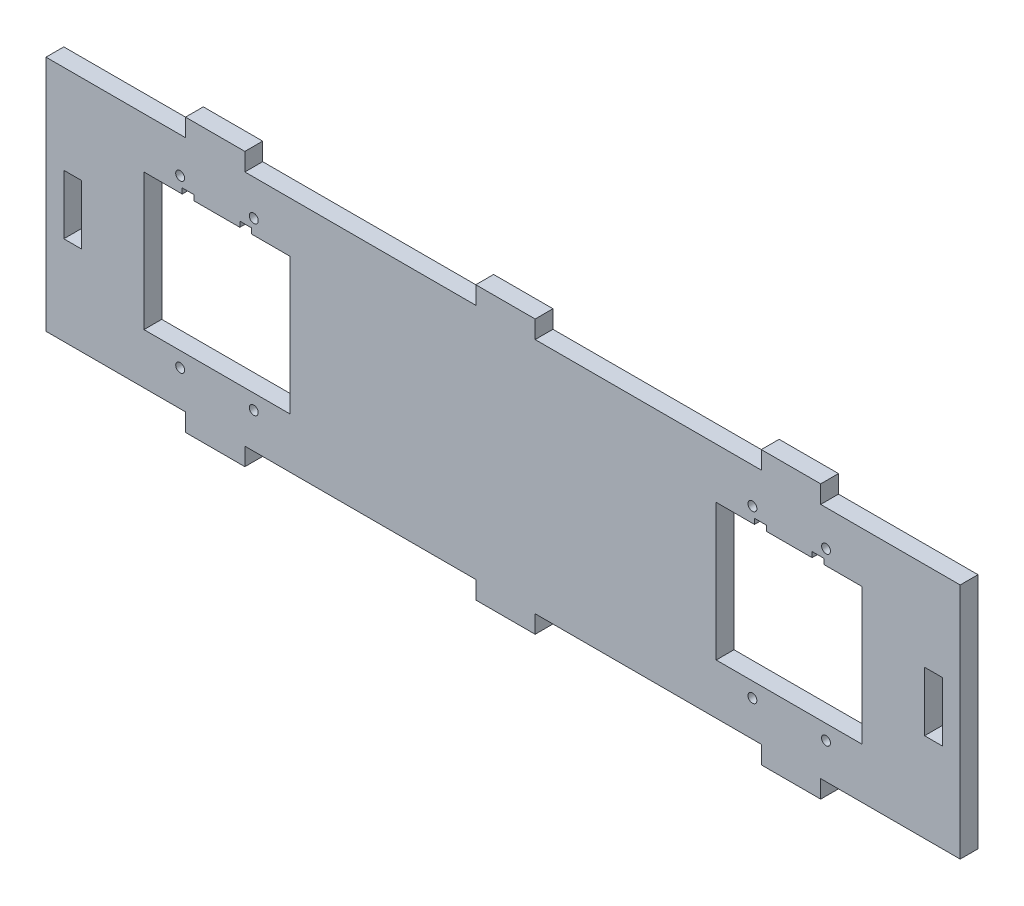
from build123d import *

# Parameters (mm, degrees)
SKETCH_1_R      = 0.75
SKETCH_1_W      = 3
SKETCH_1_H      = 10
EXTRUDE_1_DEPTH = 3


with BuildPart() as part:
    # 草图1 → 凸台-拉伸1 (new body)
    with BuildSketch(Plane.XY):
        Polygon((-43.5, -20), (-4.599481492, -20), (-4.599481492, -23), (5.400518508, -23), (5.400518508, -20), (43.5, -20), (43.5, -23), (53.5, -23), (53.5, -20), (77, -20), (77, 20), (53.5, 20), (53.5, 23), (43.5, 23), (43.5, 20), (5.400518508, 20), (5.400518508, 23), (-4.599481492, 23), (-4.599481492, 20), (-43.5, 20), (-43.5, 23), (-53.5, 23), (-53.5, 20), (-77, 20), (-77, -20), (-53.5, -20), (-53.5, -23), (-43.5, -23), align=None)
        with Locations((-54.4, -14)):
            Circle(SKETCH_1_R, mode=Mode.SUBTRACT)
        with Locations(Location((-54.4, 14, 0), (0, 0, 180))):
            Circle(SKETCH_1_R, mode=Mode.SUBTRACT)
        with Locations(Location((-42, -14, 0), (0, 0, 180))):
            Circle(SKETCH_1_R, mode=Mode.SUBTRACT)
        with Locations((-42, 14)):
            Circle(SKETCH_1_R, mode=Mode.SUBTRACT)
        with Locations((42, -14)):
            Circle(SKETCH_1_R, mode=Mode.SUBTRACT)
        with Locations(Location((54.4, -14, 0), (0, 0, 180))):
            Circle(SKETCH_1_R, mode=Mode.SUBTRACT)
        with Locations((54.4, 14)):
            Circle(SKETCH_1_R, mode=Mode.SUBTRACT)
        with Locations(Location((42, 14, 0), (0, 0, 180))):
            Circle(SKETCH_1_R, mode=Mode.SUBTRACT)
        with Locations((-72.5, 0)):
            Rectangle(SKETCH_1_W, SKETCH_1_H, mode=Mode.SUBTRACT)
        with Locations((72.5, 0)):
            Rectangle(SKETCH_1_W, SKETCH_1_H, mode=Mode.SUBTRACT)
        Polygon((-60.5, 11.5), (-54.05, 11.5), (-54.05, 12.40163795), (-52.05, 12.40163795), (-52.05, 11.5), (-44.35, 11.5), (-44.35, 12.40163795), (-42.35, 12.40163795), (-42.35, 11.5), (-35.9, 11.5), (-35.9, -11.5), (-60.5, -11.5), align=None, mode=Mode.SUBTRACT)
        Polygon((52.05, 11.5), (52.05, 12.40163795), (54.05, 12.40163795), (54.05, 11.5), (60.5, 11.5), (60.5, -11.5), (35.9, -11.5), (35.9, 11.5), (42.35, 11.5), (42.35, 12.40163795), (44.35, 12.40163795), (44.35, 11.5), align=None, mode=Mode.SUBTRACT)
    extrude(amount=EXTRUDE_1_DEPTH)


solid = part.part
